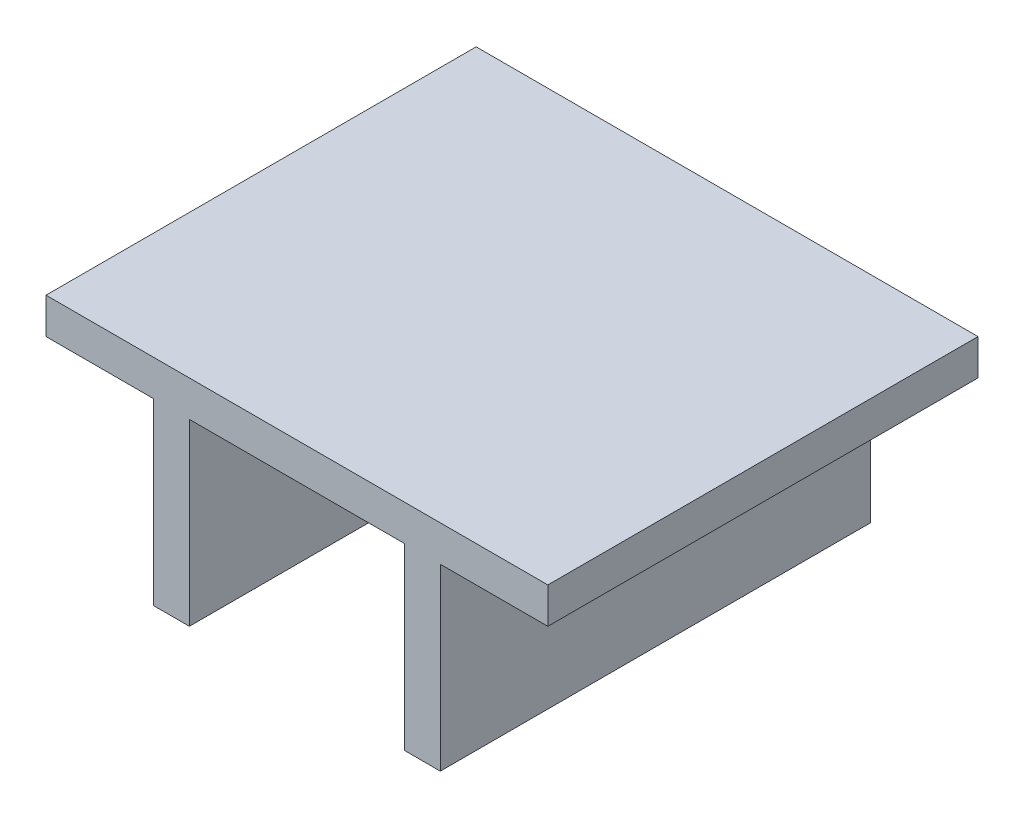
from build123d import *

# Parameters (mm, degrees)
SKETCH1_W           = 6.35
SKETCH1_H           = 31.75
BOSS_EXTRUDE1_DEPTH = 76.2


with BuildPart() as part:
    # Sketch1 → Boss-Extrude1 (new body)
    with BuildSketch(Plane.XY):
        Polygon((88.9, 0), (0, 0), (0, -6.35), (19.05, -6.35), (25.4, -6.35), (63.5, -6.35), (69.85, -6.35), (88.9, -6.35), align=None)
        with Locations((22.225, -22.225)):
            Rectangle(SKETCH1_W, SKETCH1_H)
        with Locations((66.675, -22.225)):
            Rectangle(SKETCH1_W, SKETCH1_H)
    extrude(amount=BOSS_EXTRUDE1_DEPTH)


solid = part.part
